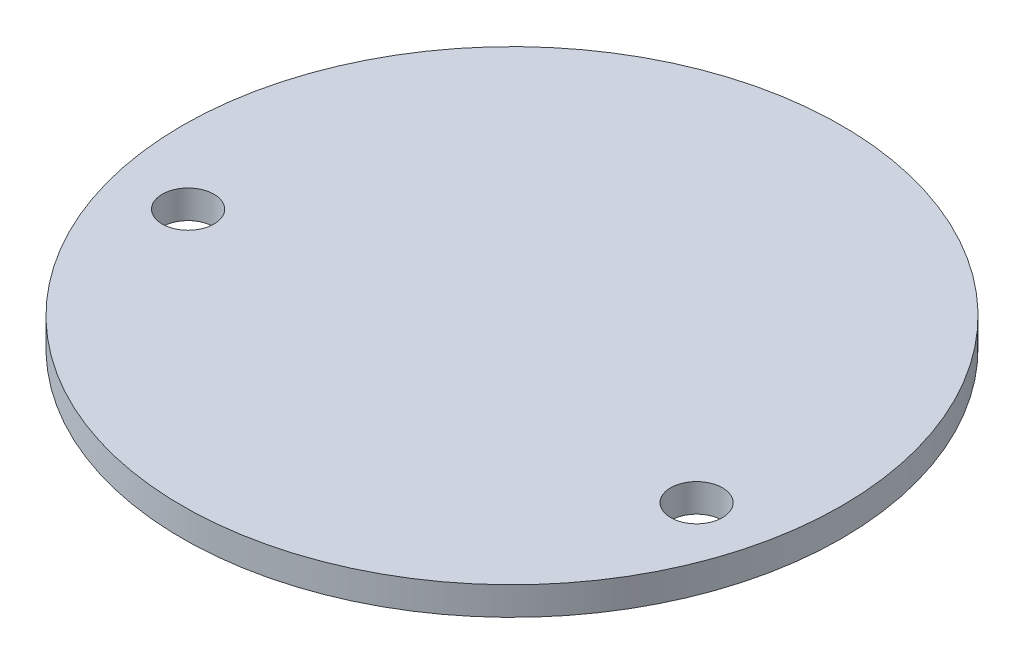
from build123d import *

# Parameters (mm, degrees)
SKETCH2_W          = 35
SKETCH2_H          = 3
CUT_EXTRUDE2_REACH = 51.588
SKETCH4_R          = 2.75


with BuildPart() as part:
    # Sketch2 → Revolve1 (revolve)
    with BuildSketch(Plane.XY):
        with Locations((17.5, 1.5)):
            Rectangle(SKETCH2_W, SKETCH2_H)
    revolve(axis=Axis((0, -417.112175525, 0), (0, 1, 0)))

    # Sketch4 → Cut-Extrude2 (cut, up to next)
    with BuildSketch(Plane(origin=(0, 3, 0), x_dir=(1, 0, 0), z_dir=(0, 1, 0)), mode=Mode.PRIVATE) as cut_extrude2_sk1:
        with Locations(Location((-27, -7.4, 0), (0, 0, 180))):
            Circle(SKETCH4_R)
    cut_extrude2_tool1 = extrude(cut_extrude2_sk1.sketch, amount=-CUT_EXTRUDE2_REACH, mode=Mode.PRIVATE) & part.part
    # Sketch4 → Cut-Extrude2 (cut, up to next)
    with BuildSketch(Plane(origin=(0, 3, 0), x_dir=(1, 0, 0), z_dir=(0, 1, 0)), mode=Mode.PRIVATE) as cut_extrude2_sk2:
        with Locations(Location((27, -7.4, 0), (0, 0, 180))):
            Circle(SKETCH4_R)
    cut_extrude2_tool2 = extrude(cut_extrude2_sk2.sketch, amount=-CUT_EXTRUDE2_REACH, mode=Mode.PRIVATE) & part.part
    add(cut_extrude2_tool1.solids().sort_by_distance((-27, 3, 7.4))[0], mode=Mode.SUBTRACT)
    add(cut_extrude2_tool2.solids().sort_by_distance((27, 3, 7.4))[0], mode=Mode.SUBTRACT)


solid = part.part
